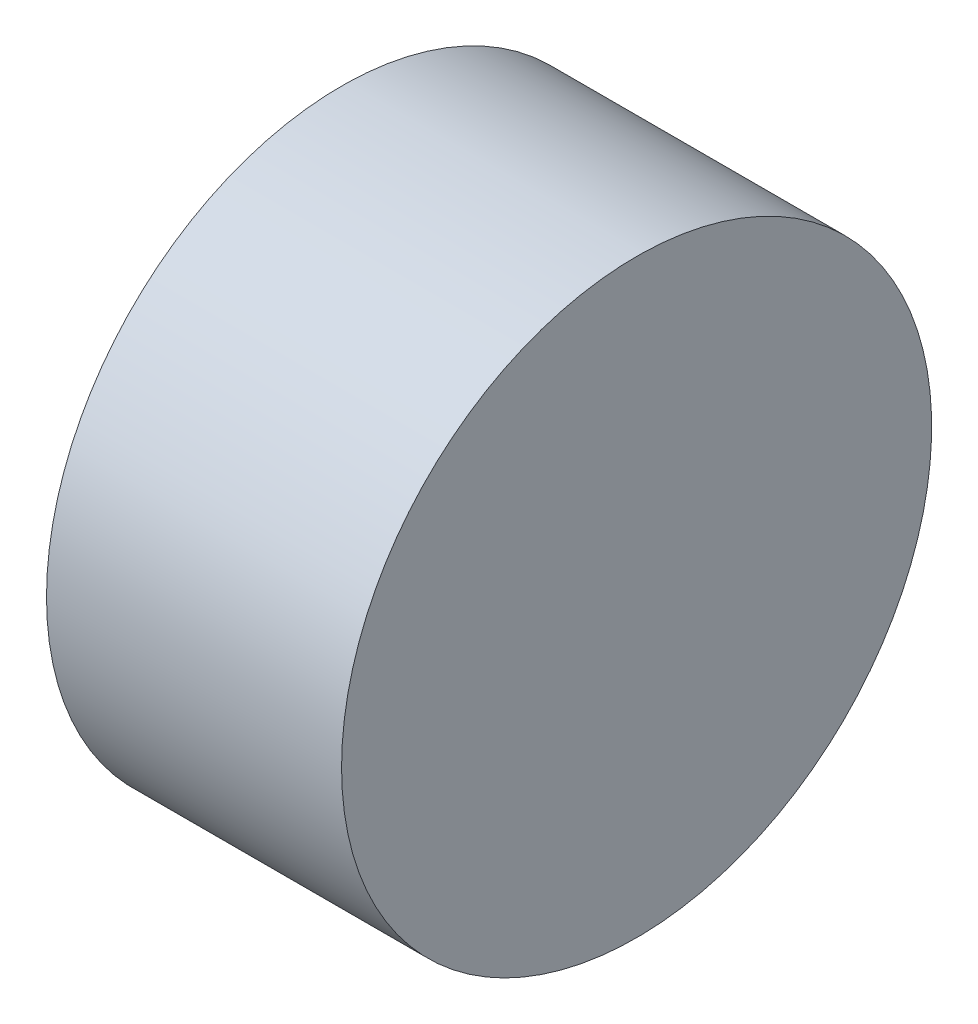
from build123d import *

# Parameters (mm, degrees)
AXIAL_PROFILE_MM_W = 5
AXIAL_PROFILE_MM_H = 5


with BuildPart() as part:
    # Axial profile (mm) → Full revolution (revolve)
    with BuildSketch(Plane.XY, mode=Mode.PRIVATE) as full_revolution_sk:
        with Locations((146.2, 2.5)):
            Rectangle(AXIAL_PROFILE_MM_W, AXIAL_PROFILE_MM_H)
    revolve(full_revolution_sk.sketch.rotate(Axis((-110, 0, 0), (1, 0, 0)), 90), axis=Axis((-110, 0, 0), (1, 0, 0)))


solid = part.part
